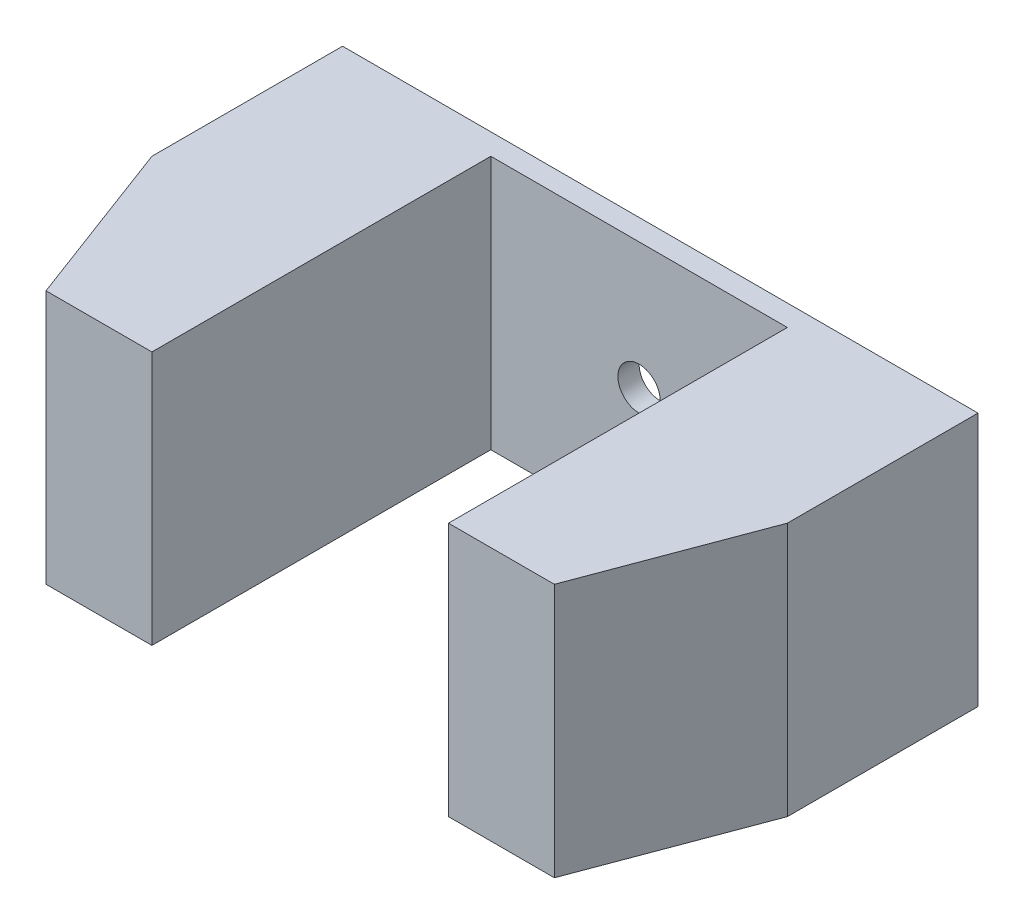
from build123d import *

# Parameters (mm, degrees)
SKETCH1_W           = 150
SKETCH1_H           = 60
SKETCH1_R           = 5
BOSS_EXTRUDE1_DEPTH = 5
BOSS_EXTRUDE2_DEPTH = 60


with BuildPart() as part:
    # Sketch1 → Boss-Extrude1 (new body)
    with BuildSketch(Plane.XY):
        Rectangle(SKETCH1_W, SKETCH1_H)
        Circle(SKETCH1_R, mode=Mode.SUBTRACT)
    extrude(amount=BOSS_EXTRUDE1_DEPTH)

    # Sketch2 → Boss-Extrude2 (add)
    with BuildSketch(Plane(origin=(0, 30, 0), x_dir=(1, 0, 0), z_dir=(0, 1, 0))):
        Polygon((-35, -85), (-35, -5), (-75, -5), (-75, -45), (-60, -85), align=None)
    boss_extrude2 = extrude(amount=-BOSS_EXTRUDE2_DEPTH)

    # Mirror1: Boss-Extrude2 across plane
    add(boss_extrude2.mirror(Plane(origin=(0, 0, 0), x_dir=(0, 0, 1), z_dir=(1, 0, 0))))


solid = part.part
